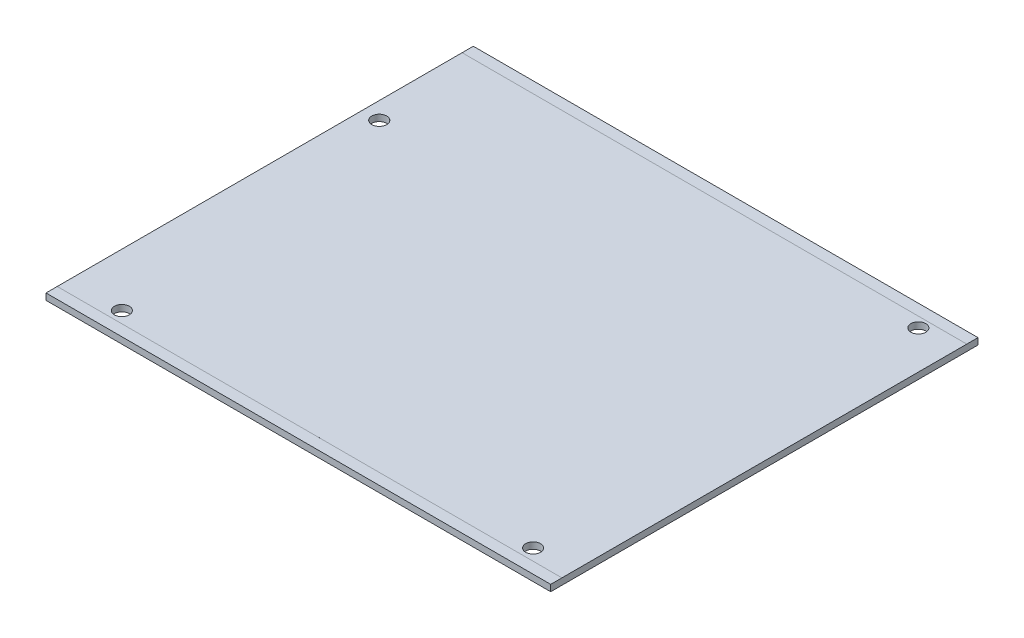
from build123d import *

# Parameters (mm, degrees)
SKETCH1_W           = 135
SKETCH1_H           = 114.3
BOSS_EXTRUDE1_DEPTH = 1.724
SKETCH3_W           = 135
SKETCH3_H           = 3
CUT_EXTRUDE2_DEPTH  = 0.0001
SKETCH4_R           = 2
CUT_EXTRUDE3_DEPTH  = 89.460978267


with BuildPart() as part:
    # Sketch1 → Boss-Extrude1 (new body)
    with BuildSketch(Plane(origin=(0, 0, 0), x_dir=(1, 0, 0), z_dir=(0, 1, 0))):
        Rectangle(SKETCH1_W, SKETCH1_H)
    extrude(amount=BOSS_EXTRUDE1_DEPTH)

    # Sketch3 → Cut-Extrude2 (cut)
    with BuildSketch(Plane(origin=(0, 1.724, 0), x_dir=(1, 0, 0), z_dir=(0, 1, 0))):
        with Locations((0, 55.65)):
            Rectangle(SKETCH3_W, SKETCH3_H)
        with Locations((0, -55.65)):
            Rectangle(SKETCH3_W, SKETCH3_H)
    extrude(amount=-CUT_EXTRUDE2_DEPTH, mode=Mode.SUBTRACT)

    # Sketch4 → Cut-Extrude3 (cut, through all)
    with BuildSketch(Plane.XZ):
        with Locations(Location((-53.275487911, 51.079761641, 0), (0, 0, 270))):
            Circle(SKETCH4_R)
        with Locations(Location((56.724512089, 51.079761641, 0), (0, 0, 270))):
            Circle(SKETCH4_R)
        with Locations(Location((57.272512089, -51.420238359, 0), (0, 0, 270))):
            Circle(SKETCH4_R)
        with Locations(Location((-62.927487911, -27.420238359, 0), (0, 0, 270))):
            Circle(SKETCH4_R)
    extrude(amount=-CUT_EXTRUDE3_DEPTH, mode=Mode.SUBTRACT)


solid = part.part
